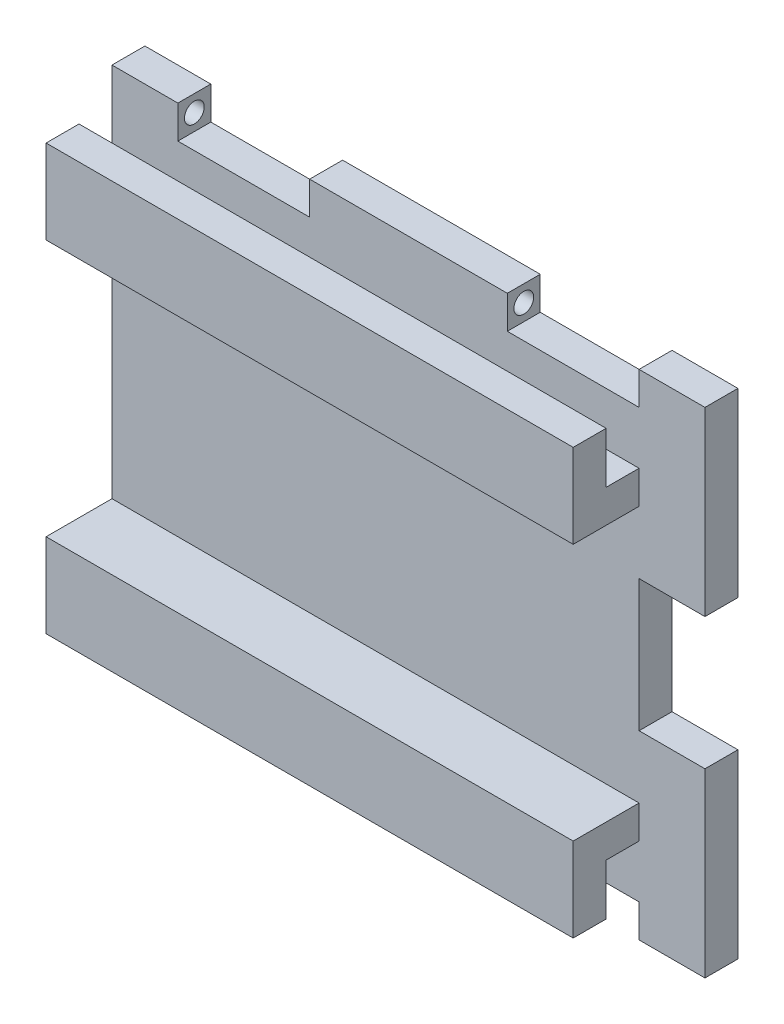
from build123d import *

# Parameters (mm, degrees)
BOSS_EXTRU_1_DEPTH      = 5
BOSS_EXTRU_2_DEPTH      = 80
ESQUISSE5_R             = 1.5
ENL_V_MAT_EXTRU_1_DEPTH = 85


with BuildPart() as part:
    # Esquisse1 → Boss.-Extru.1 (new body)
    with BuildSketch(Plane.XY):
        Polygon((90, 47.5), (80, 47.5), (80, 27.5), (90, 27.5), (90, 0), (80, 0), (80, 5), (60, 5), (60, 0), (30, 0), (30, 5), (10, 5), (10, 0), (0, 0), (0, 75), (10, 75), (10, 70), (30, 70), (30, 75), (60, 75), (60, 70), (80, 70), (80, 75), (90, 75), align=None)
    extrude(amount=BOSS_EXTRU_1_DEPTH)

    # Esquisse3 → Boss.-Extru.2 (add)
    with BuildSketch(Plane.ZY):
        Polygon((5, 18), (15, 18), (15, 5.25), (10, 5.25), (10, 13), (5, 13), align=None)
        Polygon((5, 62), (5, 57), (15, 57), (15, 69.75), (10, 69.75), (10, 62), align=None)
    extrude(amount=-BOSS_EXTRU_2_DEPTH)

    # Esquisse5 → Enlèv. mat.-Extru.1 (cut)
    with BuildSketch(Plane.ZY):
        with Locations((2.5, 2.5)):
            Circle(ESQUISSE5_R)
        with Locations((2.5, 72.5)):
            Circle(ESQUISSE5_R)
    extrude(amount=-ENL_V_MAT_EXTRU_1_DEPTH, mode=Mode.SUBTRACT)


solid = part.part
